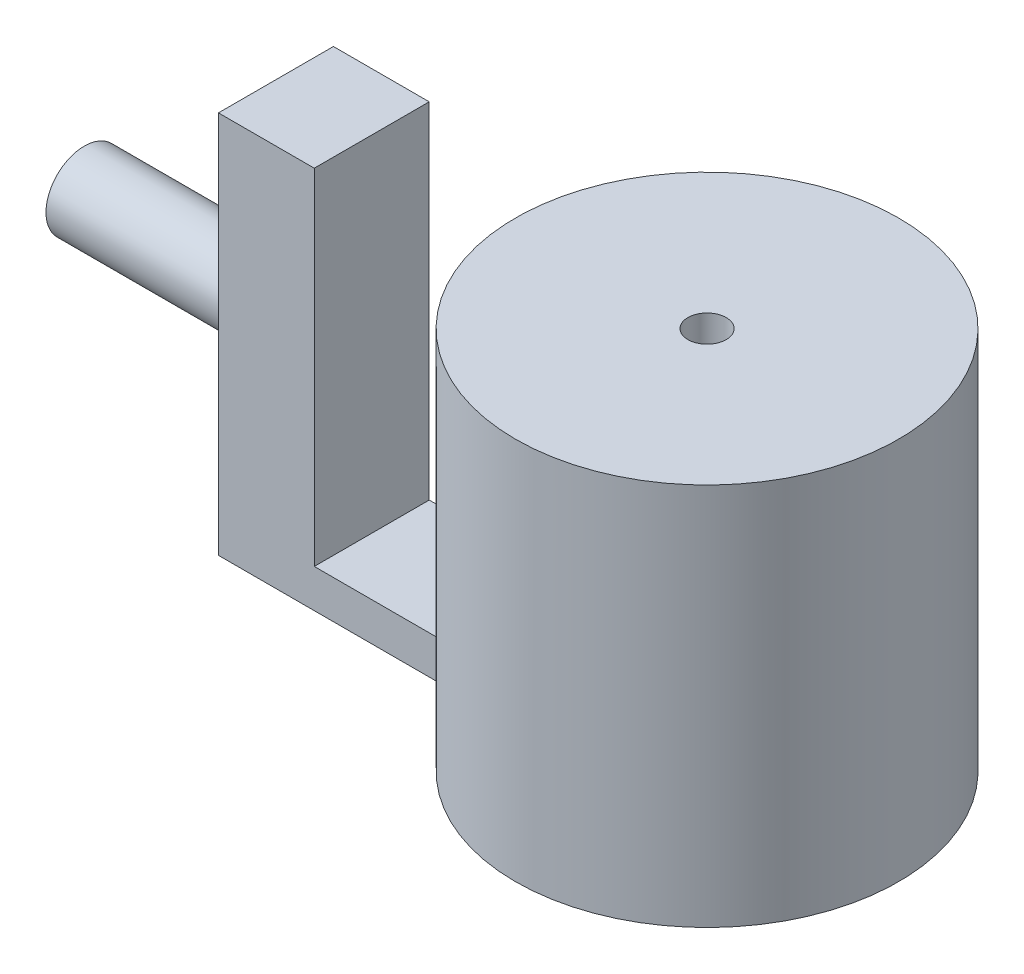
from build123d import *

# Parameters (mm, degrees)
SKETCH2_R           = 50
SKETCH2_R_2         = 5
BOSS_EXTRUDE1_DEPTH = 100
BOSS_EXTRUDE2_DEPTH = 10
SKETCH4_W           = 25
SKETCH4_H           = 30
BOSS_EXTRUDE3_DEPTH = 100
SKETCH5_R           = 10
BOSS_EXTRUDE4_DEPTH = 50


with BuildPart() as part:
    # Sketch2 → Boss-Extrude1 (new body)
    with BuildSketch(Plane(origin=(0, 0, 0), x_dir=(1, 0, 0), z_dir=(0, 1, 0))):
        with Locations(Location((0, 0, 0), (0, 0, 270))):
            Circle(SKETCH2_R)
        with Locations(Location((0, 0, 0), (0, 0, 270))):
            Circle(SKETCH2_R_2, mode=Mode.SUBTRACT)
    extrude(amount=BOSS_EXTRUDE1_DEPTH)

    # Sketch3 → Boss-Extrude2 (add)
    with BuildSketch(Plane.XZ):
        with BuildLine():
            Line((-47.696960071, -15), (-100, -15))
            Line((-100, -15), (-100, 15))
            Line((-100, 15), (-47.696960071, 15))
            ThreePointArc((-47.696960071, 15), (-50, 0), (-47.696960071, -15))
        make_face()
    extrude(amount=-BOSS_EXTRUDE2_DEPTH)

    # Sketch4 → Boss-Extrude3 (add)
    with BuildSketch(Plane.XZ):
        with Locations((-100, 0)):
            Rectangle(SKETCH4_W, SKETCH4_H)
    extrude(amount=-BOSS_EXTRUDE3_DEPTH)

    # Sketch5 → Boss-Extrude4 (add)
    with BuildSketch(Plane.ZY.offset(112.5)):
        with Locations((0, 50)):
            Circle(SKETCH5_R)
    extrude(amount=BOSS_EXTRUDE4_DEPTH)


solid = part.part
